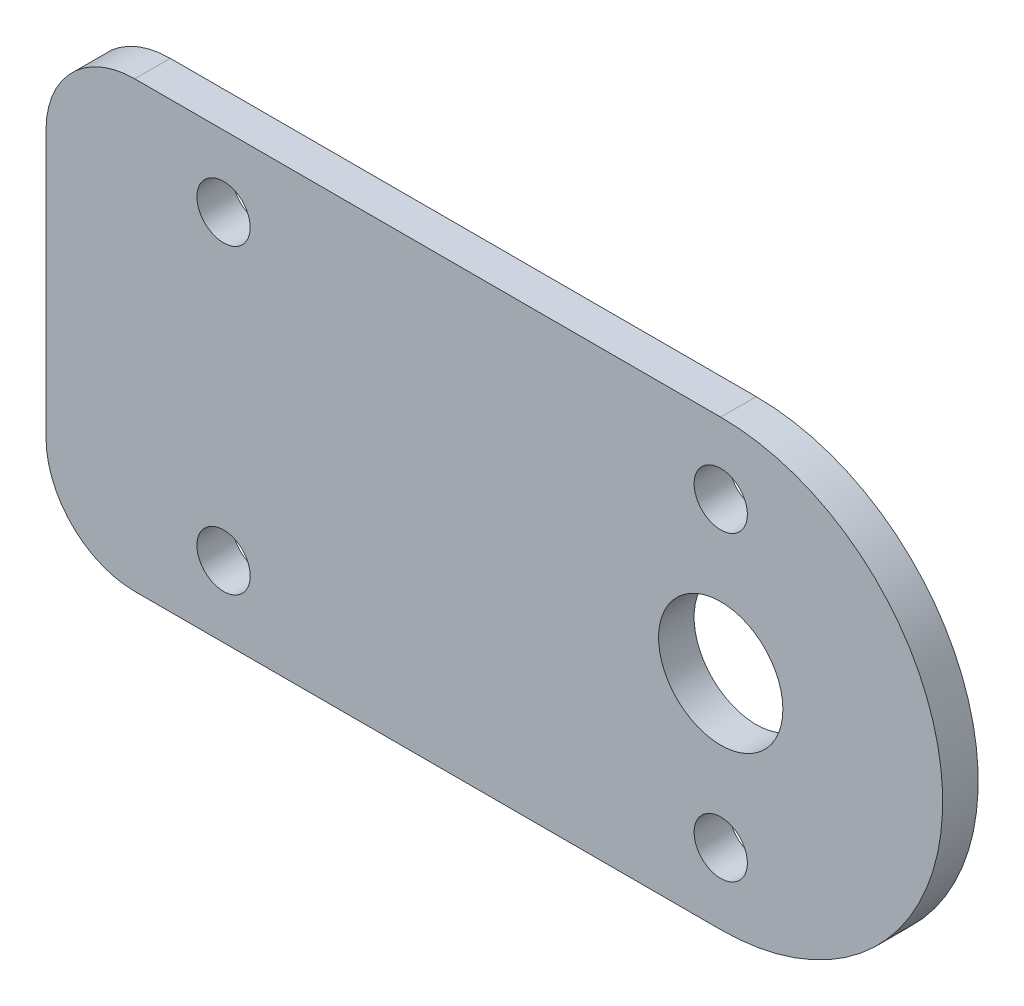
from build123d import *

# Parameters (mm, degrees)
SKETCH_1_R      = 3.5
SKETCH_1_R_2    = 1.5
EXTRUDE_1_DEPTH = 2
FILLET_1_R      = 5


with BuildPart() as part:
    # 草图1 → 凸台-拉伸1 (new body)
    with BuildSketch(Plane.XY):
        with BuildLine():
            Line((21.5, -12.5), (-16.5, -12.5))
            Line((-16.5, -12.5), (-16.5, 12.5))
            Line((-16.5, 12.5), (21.5, 12.5))
            ThreePointArc((21.5, 12.5), (34, 0), (21.5, -12.5))
        make_face()
        with Locations((21.5, 0)):
            Circle(SKETCH_1_R, mode=Mode.SUBTRACT)
        with Locations((21.5, 8.5)):
            Circle(SKETCH_1_R_2, mode=Mode.SUBTRACT)
        with Locations(Location((21.5, -8.5, 0), (0, 0, 180))):
            Circle(SKETCH_1_R_2, mode=Mode.SUBTRACT)
        with Locations((-6.5, 8.5)):
            Circle(SKETCH_1_R_2, mode=Mode.SUBTRACT)
        with Locations(Location((-6.5, -8.5, 0), (0, 0, 180))):
            Circle(SKETCH_1_R_2, mode=Mode.SUBTRACT)
    extrude(amount=EXTRUDE_1_DEPTH)

    # 圆角1
    fillet_1_edges = [part.edges().sort_by_distance(p)[0] for p in [
        (-16.5, 12.5, 1),
        (-16.5, -12.5, 1),
    ]]
    fillet(fillet_1_edges, radius=FILLET_1_R)


solid = part.part
